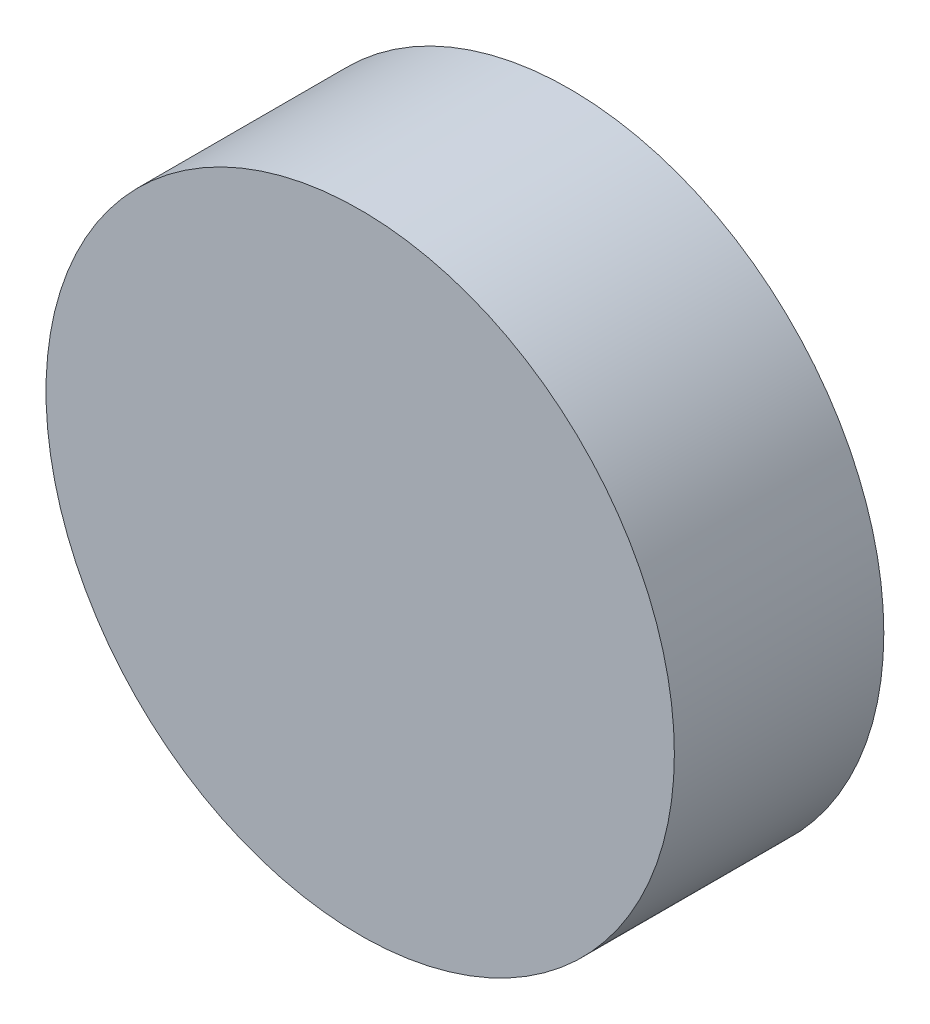
from build123d import *

# Parameters (mm, degrees)
SKETCH1_R           = 3.75
BOSS_EXTRUDE1_DEPTH = 2.5


with BuildPart() as part:
    # Sketch1 → Boss-Extrude1 (new body)
    with BuildSketch(Plane.XY):
        Circle(SKETCH1_R)
    extrude(amount=BOSS_EXTRUDE1_DEPTH)


solid = part.part
